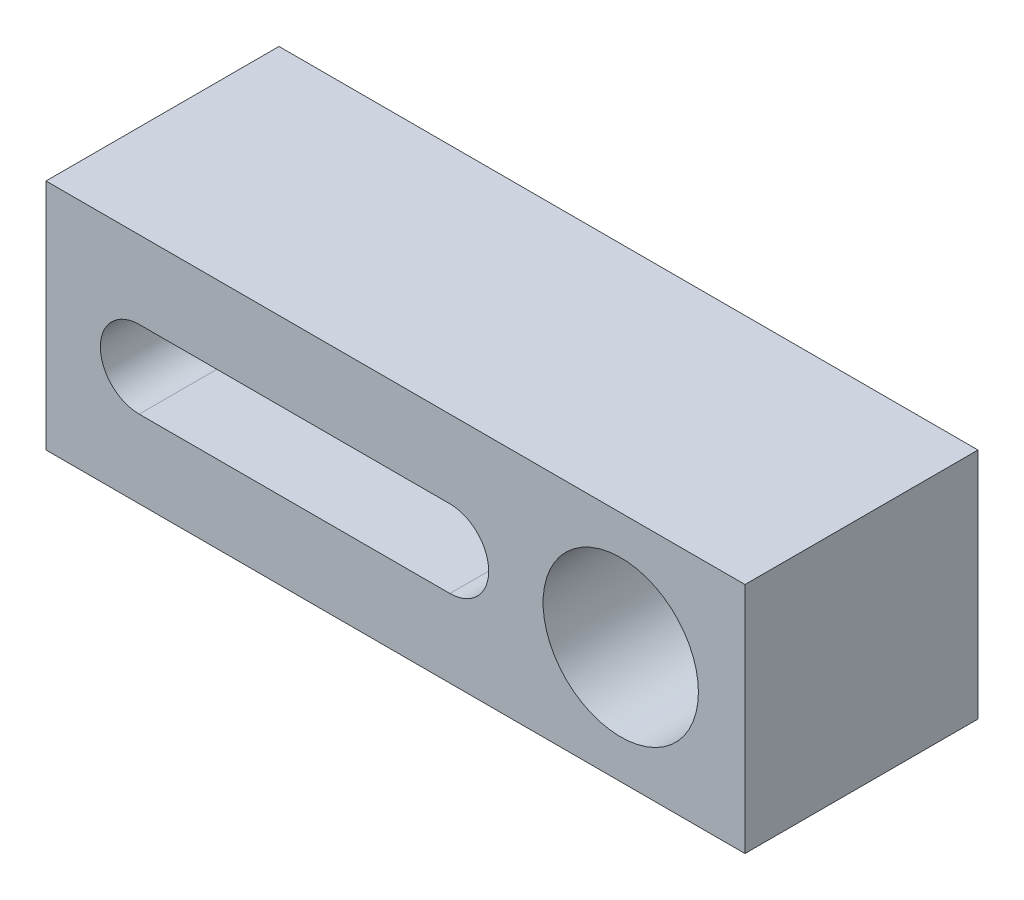
from build123d import *

# Parameters (mm, degrees)
SKETCH1_W           = 45
SKETCH1_H           = 15
SKETCH1_R           = 5
BOSS_EXTRUDE1_DEPTH = 15


with BuildPart() as part:
    # Sketch1 → Boss-Extrude1 (new body)
    with BuildSketch(Plane.XY):
        Rectangle(SKETCH1_W, SKETCH1_H)
        with Locations((14.5, 0)):
            Circle(SKETCH1_R, mode=Mode.SUBTRACT)
        with BuildLine():
            Line((3.5, -2.5), (-16.5, -2.5))
            ThreePointArc((-16.5, -2.5), (-19, 0), (-16.5, 2.5))
            Line((-16.5, 2.5), (3.5, 2.5))
            ThreePointArc((3.5, 2.5), (6, 0), (3.5, -2.5))
        make_face(mode=Mode.SUBTRACT)
    extrude(amount=BOSS_EXTRUDE1_DEPTH)


solid = part.part
